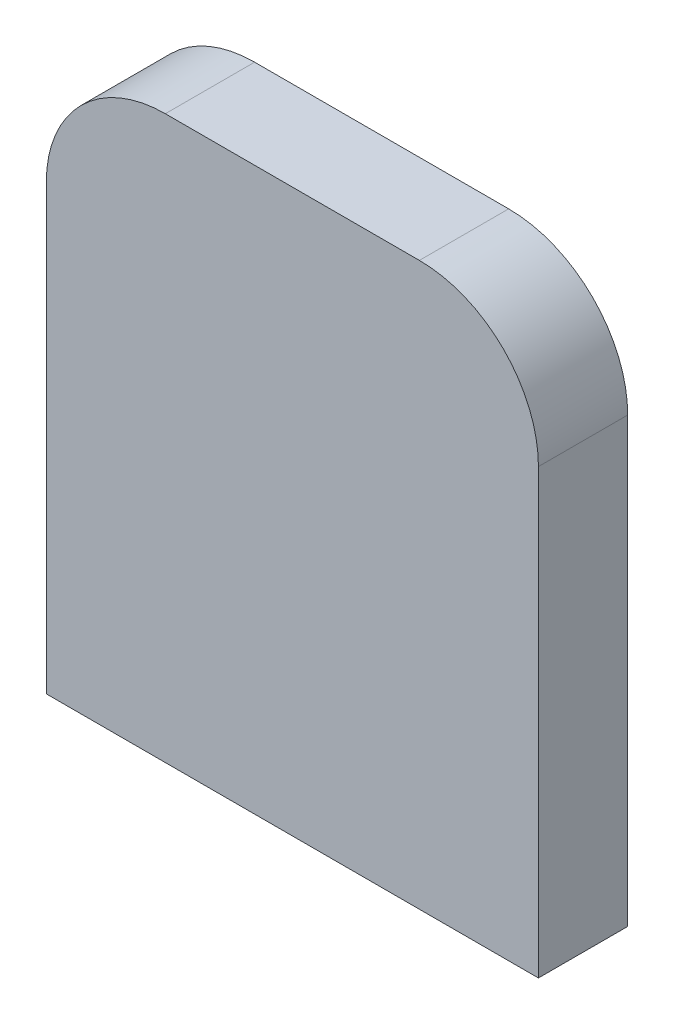
from build123d import *

# Parameters (mm, degrees)
BOSS_EXTRUDE1_DEPTH = 3


with BuildPart() as part:
    # Sketch1 → Boss-Extrude1 (new body)
    with BuildSketch(Plane.XY):
        with BuildLine():
            Line((0, 4.902054874), (16.536727361, 4.902054874))
            Line((16.536727361, 4.902054874), (16.536727361, 19.7841128))
            ThreePointArc((16.536727361, 19.7841128), (15.365154486, 22.612539925), (12.536727361, 23.7841128))
            Line((12.536727361, 23.7841128), (4, 23.7841128))
            ThreePointArc((4, 23.7841128), (1.171572875, 22.612539925), (0, 19.7841128))
            Line((0, 19.7841128), (0, 4.902054874))
        make_face()
    extrude(amount=BOSS_EXTRUDE1_DEPTH)


solid = part.part
